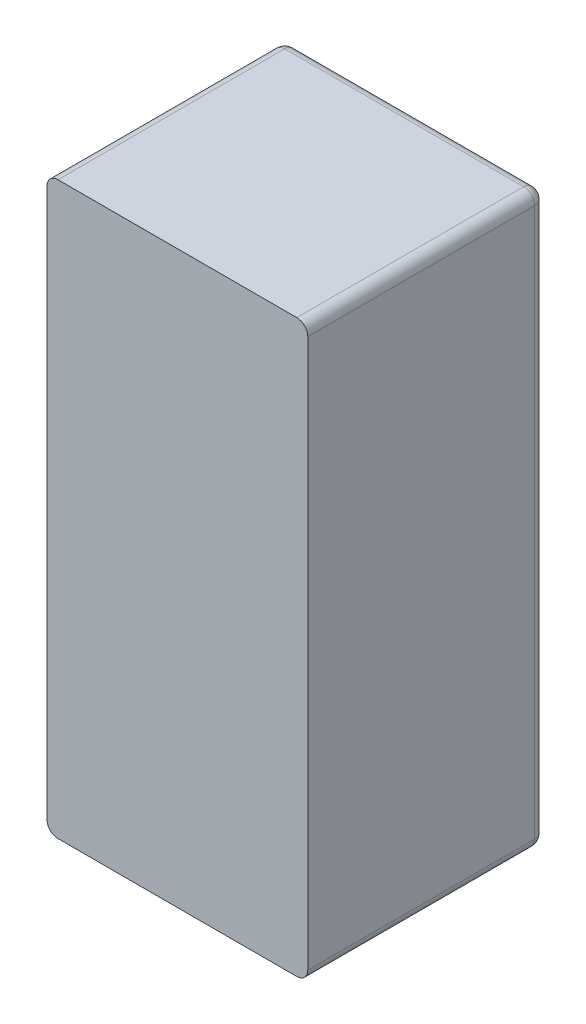
from build123d import *

# Parameters (mm, degrees)
SKETCH1_W           = 237.998
SKETCH1_H           = 216.916
BOSS_EXTRUDE1_DEPTH = 520.7
FILLET1_R           = 10


with BuildPart() as part:
    # Sketch1 → Boss-Extrude1 (new body)
    with BuildSketch(Plane(origin=(0, 0, 0), x_dir=(1, 0, 0), z_dir=(0, 1, 0))):
        with Locations((-118.999, -108.458)):
            Rectangle(SKETCH1_W, SKETCH1_H)
    extrude(amount=BOSS_EXTRUDE1_DEPTH)

    # Fillet1
    fillet1_edges = [part.edges().sort_by_distance(p)[0] for p in [
        (-237.998, 520.7, 108.458),
        (0, 520.7, 108.458),
        (-237.998, 0, 108.458),
        (-118.999, 0, 0),
        (0, 0, 108.458),
        (-237.998, 260.35, 0),
        (0, 260.35, 0),
        (-118.999, 520.7, 0),
    ]]
    fillet(fillet1_edges, radius=FILLET1_R)


with BuildPart() as part_1:
    # Body-Move/Copy1: moved
    add(part.part.moved(Location((118.999, -260.35, -108.458))))


solid = part_1.part
